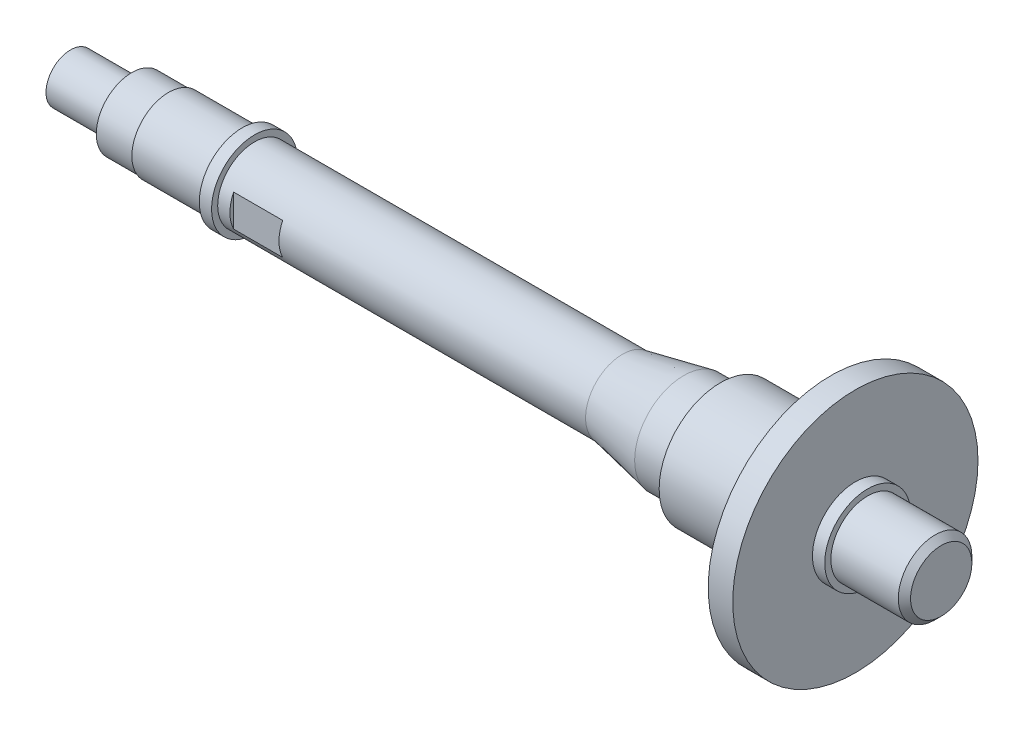
from build123d import *

# Parameters (mm, degrees)
SKETCH_1_R          = 10
EXTRUDE_1_DEPTH     = 2
SKETCH_2_R          = 3.5
EXTRUDE_2_DEPTH     = 1
SKETCH_3_R          = 6
EXTRUDE_3_DEPTH     = 9
SKETCH_4_R          = 4
EXTRUDE_4_DEPTH     = 3
SKETCH_5_R          = 3
EXTRUDE_5_DEPTH     = 6
EXTRUDE_START       = 35
SKETCH_6_R          = 3
EXTRUDE_6_DEPTH     = 35
EXTRUDE_START_2     = 1
SKETCH_7_R          = 3.5
EXTRUDE_7_DEPTH     = 1
EXTRUDE_START_3     = 9
SKETCH_8_R          = 3
EXTRUDE_8_DEPTH     = 9
SKETCH_9_R          = 2
EXTRUDE_9_DEPTH     = 5
CHAMFER_1_SIZE      = 0.5
SKETCH_11_W         = 4
SKETCH_11_H         = 0.3
CUT_EXTRUDE_2_DEPTH = 5
CUT_EXTRUDE_START   = 2
SKETCH_12_R         = 6
SKETCH_12_R_2       = 4.5
CUT_EXTRUDE_3_DEPTH = 1
CUT_EXTRUDE_START_2 = -6
SKETCH_13_R         = 6
SKETCH_13_R_2       = 5
CUT_EXTRUDE_4_DEPTH = 6
SKETCH_15_R         = 3
SKETCH_15_R_2       = 2.9
CUT_EXTRUDE_5_DEPTH = 3


with BuildPart() as part:
    # 草图1 → 凸台-拉伸1 (new body)
    with BuildSketch(Plane(origin=(0, 0, 0), x_dir=(0, 0, -1), z_dir=(1, 0, 0))):
        Circle(SKETCH_1_R)
    extrude(amount=EXTRUDE_1_DEPTH)

    # 草图2 → 凸台-拉伸2 (add)
    with BuildSketch(Plane(origin=(2, 0, 0), x_dir=(0, 0, -1), z_dir=(1, 0, 0))):
        Circle(SKETCH_2_R)
    extrude(amount=EXTRUDE_2_DEPTH)

    # 草图3 → 凸台-拉伸3 (add)
    with BuildSketch(Plane.ZY):
        with Locations(Location((0, 0, 0), (0, 0, 180))):
            Circle(SKETCH_3_R)
    extrude(amount=EXTRUDE_3_DEPTH)

    # 草图4 → 凸台-拉伸4 (add)
    with BuildSketch(Plane.ZY.offset(9)):
        Circle(SKETCH_4_R)
    extrude(amount=EXTRUDE_4_DEPTH)

    # 草图5 → 凸台-拉伸5 (add)
    with BuildSketch(Plane(origin=(3, 0, 0), x_dir=(0, 0, -1), z_dir=(1, 0, 0))):
        Circle(SKETCH_5_R)
    extrude(amount=EXTRUDE_5_DEPTH)

    # 草图6 → 凸台-拉伸6 (add)
    with BuildSketch(Plane.ZY.offset(12).offset(EXTRUDE_START)):
        with Locations(Location((0, 0, 0), (0, 0, 180))):
            Circle(SKETCH_6_R)
    extrude(amount=-EXTRUDE_6_DEPTH)

    # 草图7 → 凸台-拉伸7 (add)
    with BuildSketch(Plane.ZY.offset(47).offset(EXTRUDE_START_2)):
        with Locations(Location((0, 0, 0), (0, 0, 180))):
            Circle(SKETCH_7_R)
    extrude(amount=-EXTRUDE_7_DEPTH)

    # 草图8 → 凸台-拉伸8 (add)
    with BuildSketch(Plane.ZY.offset(48).offset(EXTRUDE_START_3)):
        with Locations(Location((0, 0, 0), (0, 0, 180))):
            Circle(SKETCH_8_R)
    extrude(amount=-EXTRUDE_8_DEPTH)

    # 草图9 → 凸台-拉伸9 (add)
    with BuildSketch(Plane.ZY.offset(57)):
        Circle(SKETCH_9_R)
    extrude(amount=EXTRUDE_9_DEPTH)

    # 倒角1
    chamfer_1_edges = [part.edges().sort_by_distance(p)[0] for p in [
        (9, 0, 3),
    ]]
    chamfer(chamfer_1_edges, length=CHAMFER_1_SIZE)

    # 草图11 → 切除-拉伸2 (cut, symmetric)
    with BuildSketch(Plane(origin=(0, 0, 0), x_dir=(1, 0, 0), z_dir=(0, 1, 0))):
        with Locations((-44, 2.85)):
            Rectangle(SKETCH_11_W, SKETCH_11_H)
        with Locations((-44, -2.85)):
            Rectangle(SKETCH_11_W, SKETCH_11_H)
    extrude(amount=CUT_EXTRUDE_2_DEPTH, both=True, mode=Mode.SUBTRACT)

    # 草图12 → 切除-拉伸3 (cut)
    with BuildSketch(Plane.ZY.offset(CUT_EXTRUDE_START)):
        Circle(SKETCH_12_R)
        Circle(SKETCH_12_R_2, mode=Mode.SUBTRACT)
    extrude(amount=CUT_EXTRUDE_3_DEPTH, mode=Mode.SUBTRACT)

    # 草图13 → 切除-拉伸4 (cut)
    with BuildSketch(Plane.ZY.offset(9).offset(CUT_EXTRUDE_START_2)):
        with Locations(Location((0, 0, 0), (0, 0, 180))):
            Circle(SKETCH_13_R)
        Circle(SKETCH_13_R_2, mode=Mode.SUBTRACT)
    extrude(amount=CUT_EXTRUDE_4_DEPTH, mode=Mode.SUBTRACT)

    # 草图14 → 旋转1 (revolve)
    with BuildSketch(Plane.XY, mode=Mode.PRIVATE) as revolve_1_sk:
        Polygon((-12, 4), (-17, 3), (-12, 3), align=None)
    revolve(revolve_1_sk.sketch.rotate(Axis((-6.238584256, 0, 0), (-1, 0, 0)), 90), axis=Axis((-6.238584256, 0, 0), (-1, 0, 0)))

    # 草图15 → 切除-拉伸5 (cut)
    with BuildSketch(Plane.ZY.offset(57)):
        Circle(SKETCH_15_R)
        Circle(SKETCH_15_R_2, mode=Mode.SUBTRACT)
    extrude(amount=-CUT_EXTRUDE_5_DEPTH, mode=Mode.SUBTRACT)


solid = part.part
